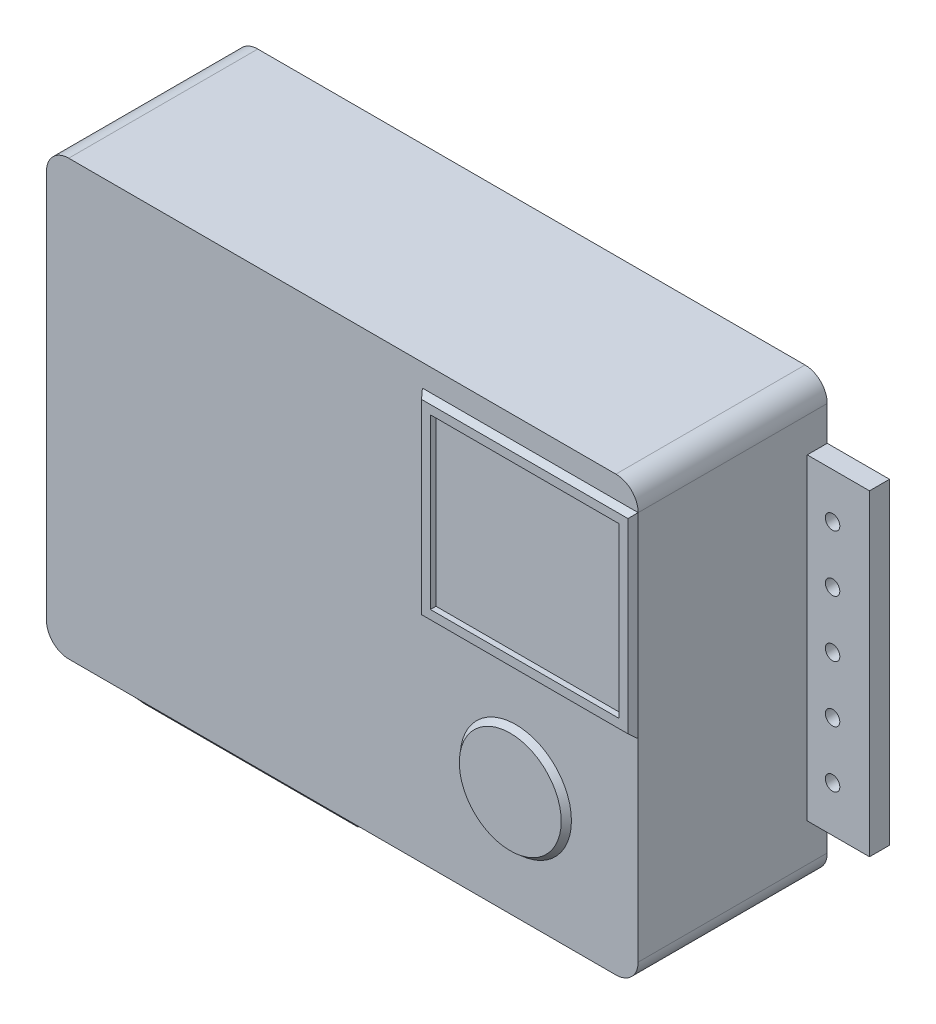
from build123d import *

# Parameters (mm, degrees)
SKETCH1_W                     = 26.6
SKETCH1_H                     = 19.5
BASE_DEPTH                    = 8.5
SKETCH2_R                     = 2.5
BOSS_EXTRUDE2_DEPTH           = 0.25
BOSS_EXTRUDE2_DRAFT           = 40
SKETCH2_W                     = 9.7
SKETCH2_H                     = 8.8
BOSS_EXTRUDE2_PROFILE_2_DEPTH = 0.25
BOSS_EXTRUDE2_PROFILE_2_DRAFT = 40
SKETCH3_W                     = 8.480450184
SKETCH3_H                     = 7.580450184
CUT_EXTRUDE1_DEPTH            = 0.25
SKETCH4_W                     = 10
SKETCH4_H                     = 8.5
BOSS_EXTRUDE3_DEPTH           = 0.25
BOSS_EXTRUDE3_TAPER           = 40
SKETCH5_W                     = 8.980450184
SKETCH5_H                     = 7.480450184
CUT_EXTRUDE2_DEPTH            = 0.25
FILLET1_R                     = 1
SKETCH6_W                     = 6.5
SKETCH6_H                     = 2.5
CONNECTOR1_DEPTH              = 0.2
SKETCH7_W                     = 4.5
SKETCH7_H                     = 2.2
CONNECTOR2_DEPTH              = 0.25
SKETCH8_W                     = 3.3
SKETCH8_H                     = 13
SKETCH8_W_2                   = 2.8
SKETCH8_H_2                   = 14.25
PCB_DEPTH                     = 0.9
CUT_EXTRUDE3_REACH            = 23.263
SKETCH9_R                     = 0.325


with BuildPart() as part:
    # Sketch1 → Base (new body)
    with BuildSketch(Plane.XY):
        Rectangle(SKETCH1_W, SKETCH1_H)
    extrude(amount=BASE_DEPTH)


with BuildPart() as boss_extrude2_tool:
    # Sketch2 → Boss-Extrude2 (with draft: the straight prism first)
    with BuildSketch(Plane.XY.offset(8.5)):
        with Locations((7.8, -4.75)):
            Circle(SKETCH2_R)
    extrude(amount=BOSS_EXTRUDE2_DEPTH)
    # Boss-Extrude2: the draft: its side faces are tilted about the plane it starts from
    boss_extrude2_sides = [boss_extrude2_tool.faces().sort_by_distance(p)[0] for p in [
        (5.3, -4.75, 8.625),
    ]]
    draft(boss_extrude2_sides, Plane.XY.offset(8.5), BOSS_EXTRUDE2_DRAFT)


with BuildPart() as part_1:
    add(part.part)

    # Boss-Extrude2: add boss_extrude2_tool
    add(boss_extrude2_tool.part)


with BuildPart() as boss_extrude2_profile_2_tool:
    # Sketch2 → Boss-Extrude2 profile 2 (with draft: the straight prism first)
    with BuildSketch(Plane.XY.offset(8.5)):
        with Locations((8.45, 4.35)):
            Rectangle(SKETCH2_W, SKETCH2_H)
    extrude(amount=BOSS_EXTRUDE2_PROFILE_2_DEPTH)
    # Boss-Extrude2 profile 2: the draft: its side faces are tilted about the plane it starts from
    boss_extrude2_profile_2_sides = [boss_extrude2_profile_2_tool.faces().sort_by_distance(p)[0] for p in [
        (3.6, 4.35, 8.625),
        (8.45, -0.05, 8.625),
        (13.3, 4.35, 8.625),
        (8.45, 8.75, 8.625),
    ]]
    draft(boss_extrude2_profile_2_sides, Plane.XY.offset(8.5), BOSS_EXTRUDE2_PROFILE_2_DRAFT)


with BuildPart() as part_2:
    add(part_1.part)

    # Boss-Extrude2 profile 2: add boss_extrude2_profile_2_tool
    add(boss_extrude2_profile_2_tool.part)

    # Sketch3 → Cut-Extrude1 (cut)
    with BuildSketch(Plane.XY.offset(8.75)):
        with Locations((8.45, 4.35)):
            Rectangle(SKETCH3_W, SKETCH3_H)
    extrude(amount=-CUT_EXTRUDE1_DEPTH, mode=Mode.SUBTRACT)

    # Sketch4 → Boss-Extrude3 (add)
    with BuildSketch(Plane.XZ.offset(9.75)):
        with Locations((-4.3, 4.25)):
            Rectangle(SKETCH4_W, SKETCH4_H)
    extrude(amount=BOSS_EXTRUDE3_DEPTH, taper=BOSS_EXTRUDE3_TAPER)

    # Sketch5 → Cut-Extrude2 (cut)
    with BuildSketch(Plane.XZ.offset(10)):
        with Locations((-4.3, 4.25)):
            Rectangle(SKETCH5_W, SKETCH5_H)
    extrude(amount=-CUT_EXTRUDE2_DEPTH, mode=Mode.SUBTRACT)

    # Fillet1
    fillet1_edges = [part_2.edges().sort_by_distance(p)[0] for p in [
        (-13.3, 9.75, 4.25),
        (13.3, 9.75, 4.25),
        (13.3, -9.75, 4.25),
        (-13.3, -9.75, 4.25),
    ]]
    fillet(fillet1_edges, radius=FILLET1_R)

    # Sketch6 → Connector1 (add)
    with BuildSketch(Plane(origin=(0, 0, 0), x_dir=(-1, 0, 0), z_dir=(0, 0, -1))):
        with Locations((0.95, 4.8)):
            Rectangle(SKETCH6_W, SKETCH6_H)
    extrude(amount=CONNECTOR1_DEPTH)

    # Sketch7 → Connector2 (add)
    with BuildSketch(Plane(origin=(0, 0, -0.2), x_dir=(-1, 0, 0), z_dir=(0, 0, -1))):
        with Locations((0.95, 4.8)):
            Rectangle(SKETCH7_W, SKETCH7_H)
    extrude(amount=CONNECTOR2_DEPTH)

    # Sketch8 → PCB (add)
    with BuildSketch(Plane(origin=(0, 0, 0), x_dir=(-1, 0, 0), z_dir=(0, 0, -1))):
        with Locations((14.95, -1.25)):
            Rectangle(SKETCH8_W, SKETCH8_H)
        with Locations((-14.7, 0.075)):
            Rectangle(SKETCH8_W_2, SKETCH8_H_2)
    extrude(amount=-PCB_DEPTH)

    # Sketch9 → Cut-Extrude3 (cut, up to next)
    with BuildSketch(Plane(origin=(0, 0, 0), x_dir=(-1, 0, 0), z_dir=(0, 0, -1)), mode=Mode.PRIVATE) as cut_extrude3_sk1:
        with Locations((15.1, -5.05)):
            Circle(SKETCH9_R)
    cut_extrude3_tool1 = extrude(cut_extrude3_sk1.sketch, amount=-CUT_EXTRUDE3_REACH, mode=Mode.PRIVATE) & part_2.part
    # Sketch9 → Cut-Extrude3 (cut, up to next)
    with BuildSketch(Plane(origin=(0, 0, 0), x_dir=(-1, 0, 0), z_dir=(0, 0, -1)), mode=Mode.PRIVATE) as cut_extrude3_sk2:
        with Locations((15.1, -2.51)):
            Circle(SKETCH9_R)
    cut_extrude3_tool2 = extrude(cut_extrude3_sk2.sketch, amount=-CUT_EXTRUDE3_REACH, mode=Mode.PRIVATE) & part_2.part
    # Sketch9 → Cut-Extrude3 (cut, up to next)
    with BuildSketch(Plane(origin=(0, 0, 0), x_dir=(-1, 0, 0), z_dir=(0, 0, -1)), mode=Mode.PRIVATE) as cut_extrude3_sk3:
        with Locations((15.1, 0.03)):
            Circle(SKETCH9_R)
    cut_extrude3_tool3 = extrude(cut_extrude3_sk3.sketch, amount=-CUT_EXTRUDE3_REACH, mode=Mode.PRIVATE) & part_2.part
    # Sketch9 → Cut-Extrude3 (cut, up to next)
    with BuildSketch(Plane(origin=(0, 0, 0), x_dir=(-1, 0, 0), z_dir=(0, 0, -1)), mode=Mode.PRIVATE) as cut_extrude3_sk4:
        with Locations((15.1, 2.57)):
            Circle(SKETCH9_R)
    cut_extrude3_tool4 = extrude(cut_extrude3_sk4.sketch, amount=-CUT_EXTRUDE3_REACH, mode=Mode.PRIVATE) & part_2.part
    # Sketch9 → Cut-Extrude3 (cut, up to next)
    with BuildSketch(Plane(origin=(0, 0, 0), x_dir=(-1, 0, 0), z_dir=(0, 0, -1)), mode=Mode.PRIVATE) as cut_extrude3_sk5:
        with Locations((-14.44, -5)):
            Circle(SKETCH9_R)
    cut_extrude3_tool5 = extrude(cut_extrude3_sk5.sketch, amount=-CUT_EXTRUDE3_REACH, mode=Mode.PRIVATE) & part_2.part
    # Sketch9 → Cut-Extrude3 (cut, up to next)
    with BuildSketch(Plane(origin=(0, 0, 0), x_dir=(-1, 0, 0), z_dir=(0, 0, -1)), mode=Mode.PRIVATE) as cut_extrude3_sk6:
        with Locations((-14.44, -2.46)):
            Circle(SKETCH9_R)
    cut_extrude3_tool6 = extrude(cut_extrude3_sk6.sketch, amount=-CUT_EXTRUDE3_REACH, mode=Mode.PRIVATE) & part_2.part
    # Sketch9 → Cut-Extrude3 (cut, up to next)
    with BuildSketch(Plane(origin=(0, 0, 0), x_dir=(-1, 0, 0), z_dir=(0, 0, -1)), mode=Mode.PRIVATE) as cut_extrude3_sk7:
        with Locations((-14.44, 0.08)):
            Circle(SKETCH9_R)
    cut_extrude3_tool7 = extrude(cut_extrude3_sk7.sketch, amount=-CUT_EXTRUDE3_REACH, mode=Mode.PRIVATE) & part_2.part
    # Sketch9 → Cut-Extrude3 (cut, up to next)
    with BuildSketch(Plane(origin=(0, 0, 0), x_dir=(-1, 0, 0), z_dir=(0, 0, -1)), mode=Mode.PRIVATE) as cut_extrude3_sk8:
        with Locations((-14.44, 2.62)):
            Circle(SKETCH9_R)
    cut_extrude3_tool8 = extrude(cut_extrude3_sk8.sketch, amount=-CUT_EXTRUDE3_REACH, mode=Mode.PRIVATE) & part_2.part
    # Sketch9 → Cut-Extrude3 (cut, up to next)
    with BuildSketch(Plane(origin=(0, 0, 0), x_dir=(-1, 0, 0), z_dir=(0, 0, -1)), mode=Mode.PRIVATE) as cut_extrude3_sk9:
        with Locations((-14.44, 5.16)):
            Circle(SKETCH9_R)
    cut_extrude3_tool9 = extrude(cut_extrude3_sk9.sketch, amount=-CUT_EXTRUDE3_REACH, mode=Mode.PRIVATE) & part_2.part
    add(cut_extrude3_tool1.solids().sort_by_distance((-15.1, -5.05, 0))[0], mode=Mode.SUBTRACT)
    add(cut_extrude3_tool2.solids().sort_by_distance((-15.1, -2.51, 0))[0], mode=Mode.SUBTRACT)
    add(cut_extrude3_tool3.solids().sort_by_distance((-15.1, 0.03, 0))[0], mode=Mode.SUBTRACT)
    add(cut_extrude3_tool4.solids().sort_by_distance((-15.1, 2.57, 0))[0], mode=Mode.SUBTRACT)
    add(cut_extrude3_tool5.solids().sort_by_distance((14.44, -5, 0))[0], mode=Mode.SUBTRACT)
    add(cut_extrude3_tool6.solids().sort_by_distance((14.44, -2.46, 0))[0], mode=Mode.SUBTRACT)
    add(cut_extrude3_tool7.solids().sort_by_distance((14.44, 0.08, 0))[0], mode=Mode.SUBTRACT)
    add(cut_extrude3_tool8.solids().sort_by_distance((14.44, 2.62, 0))[0], mode=Mode.SUBTRACT)
    add(cut_extrude3_tool9.solids().sort_by_distance((14.44, 5.16, 0))[0], mode=Mode.SUBTRACT)


solid = part_2.part
